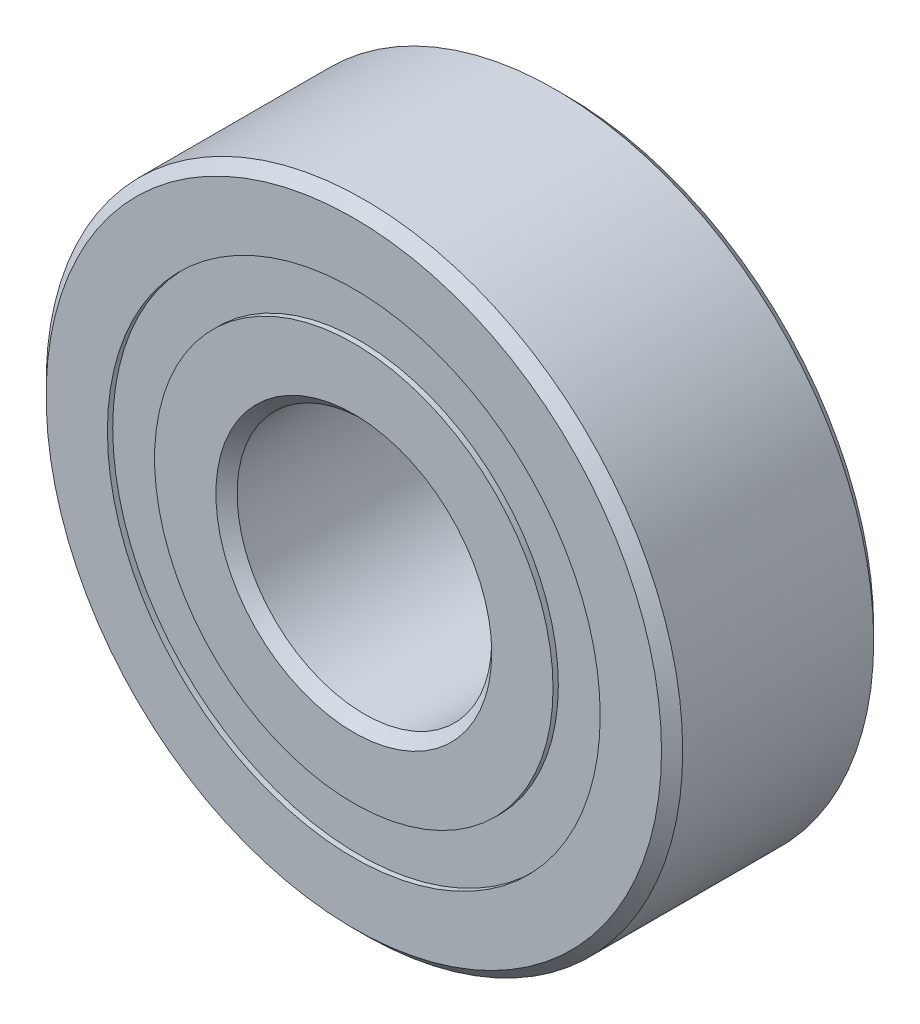
from build123d import *

# Parameters (mm, degrees)
CIRPATTERN1_COUNT = 12
SKETCH5_W         = 1.132740013
SKETCH5_H         = 1.111111112


with BuildPart() as part:
    # Sketch1 → Revolve1 (revolve)
    with BuildSketch(Plane(origin=(0, 0, 0), x_dir=(0, 0, -1), z_dir=(1, 0, 0))):
        with BuildLine():
            Line((2.25, 7.5), (-2.25, 7.5))
            Line((-2.25, 7.5), (-2.5, 7.25))
            Line((-2.5, 7.25), (-2.5, 5.805555556))
            Line((-2.5, 5.805555556), (-1.111111111, 5.805555556))
            ThreePointArc((-1.111111111, 5.805555556), (0, 6.492259987), (1.111111111, 5.805555556))
            Line((1.111111111, 5.805555556), (2.5, 5.805555556))
            Line((2.5, 5.805555556), (2.5, 7.25))
            Line((2.5, 7.25), (2.25, 7.5))
        make_face()
    revolve(axis=Axis((0, 0, 2.5), (0, 0, -1)))


with BuildPart() as body_2:
    # Sketch2 → Revolve2 (revolve)
    with BuildSketch(Plane(origin=(0, 0, 0), x_dir=(0, 0, -1), z_dir=(1, 0, 0))):
        with BuildLine():
            Line((-2.5, 4.694444444), (-1.111111111, 4.694444444))
            ThreePointArc((-1.111111111, 4.694444444), (0, 4.007740013), (1.111111111, 4.694444444))
            Line((1.111111111, 4.694444444), (2.5, 4.694444444))
            Line((2.5, 4.694444444), (2.5, 3.25))
            Line((2.5, 3.25), (2.25, 3))
            Line((2.25, 3), (-2.25, 3))
            Line((-2.25, 3), (-2.5, 3.25))
            Line((-2.5, 3.25), (-2.5, 4.694444444))
        make_face()
    revolve(axis=Axis((0, 0, 2.5), (0, 0, -1)))


with BuildPart() as body_3:
    # Sketch3 → Revolve3 (revolve)
    with BuildSketch(Plane(origin=(0, 0, 0), x_dir=(0, 0, -1), z_dir=(1, 0, 0))):
        with BuildLine():
            Line((-1.242259987, 5.25), (1.242259987, 5.25))
            ThreePointArc((1.242259987, 5.25), (0, 6.492259987), (-1.242259987, 5.25))
        make_face()
    revolve(axis=Axis((0, 5.25, 1.242259987), (0, 0, -1)))


with BuildPart() as cirpattern1_1:
    # CirPattern1: pattern copy
    add(body_3.part.rotate(Axis((0, 0, -2.5), (0, 0, 1)), 1 * 360 / CIRPATTERN1_COUNT))


with BuildPart() as cirpattern1_2:
    # CirPattern1: pattern copy
    add(body_3.part.rotate(Axis((0, 0, -2.5), (0, 0, 1)), 2 * 360 / CIRPATTERN1_COUNT))


with BuildPart() as cirpattern1_3:
    # CirPattern1: pattern copy
    add(body_3.part.rotate(Axis((0, 0, -2.5), (0, 0, 1)), 3 * 360 / CIRPATTERN1_COUNT))


with BuildPart() as cirpattern1_4:
    # CirPattern1: pattern copy
    add(body_3.part.rotate(Axis((0, 0, -2.5), (0, 0, 1)), 4 * 360 / CIRPATTERN1_COUNT))


with BuildPart() as cirpattern1_5:
    # CirPattern1: pattern copy
    add(body_3.part.rotate(Axis((0, 0, -2.5), (0, 0, 1)), 5 * 360 / CIRPATTERN1_COUNT))


with BuildPart() as cirpattern1_6:
    # CirPattern1: pattern copy
    add(body_3.part.rotate(Axis((0, 0, -2.5), (0, 0, 1)), 6 * 360 / CIRPATTERN1_COUNT))


with BuildPart() as cirpattern1_7:
    # CirPattern1: pattern copy
    add(body_3.part.rotate(Axis((0, 0, -2.5), (0, 0, 1)), 7 * 360 / CIRPATTERN1_COUNT))


with BuildPart() as cirpattern1_8:
    # CirPattern1: pattern copy
    add(body_3.part.rotate(Axis((0, 0, -2.5), (0, 0, 1)), 8 * 360 / CIRPATTERN1_COUNT))


with BuildPart() as cirpattern1_9:
    # CirPattern1: pattern copy
    add(body_3.part.rotate(Axis((0, 0, -2.5), (0, 0, 1)), 9 * 360 / CIRPATTERN1_COUNT))


with BuildPart() as cirpattern1_10:
    # CirPattern1: pattern copy
    add(body_3.part.rotate(Axis((0, 0, -2.5), (0, 0, 1)), 10 * 360 / CIRPATTERN1_COUNT))


with BuildPart() as cirpattern1_11:
    # CirPattern1: pattern copy
    add(body_3.part.rotate(Axis((0, 0, -2.5), (0, 0, 1)), 11 * 360 / CIRPATTERN1_COUNT))


with BuildPart() as body_15:
    # Sketch5 → Revolve5 (revolve)
    with BuildSketch(Plane(origin=(0, 0, 0), x_dir=(0, 0, -1), z_dir=(1, 0, 0))):
        with Locations((-1.808629994, 5.25)):
            Rectangle(SKETCH5_W, SKETCH5_H)
        with Locations((1.808629994, 5.25)):
            Rectangle(SKETCH5_W, SKETCH5_H)
    revolve(axis=Axis((0, 0, 2.5), (0, 0, -1)))


solid = Compound([part.part, body_2.part, body_3.part, cirpattern1_1.part, cirpattern1_2.part, cirpattern1_3.part, cirpattern1_4.part, cirpattern1_5.part, cirpattern1_6.part, cirpattern1_7.part, cirpattern1_8.part, cirpattern1_9.part, cirpattern1_10.part, cirpattern1_11.part, body_15.part])
